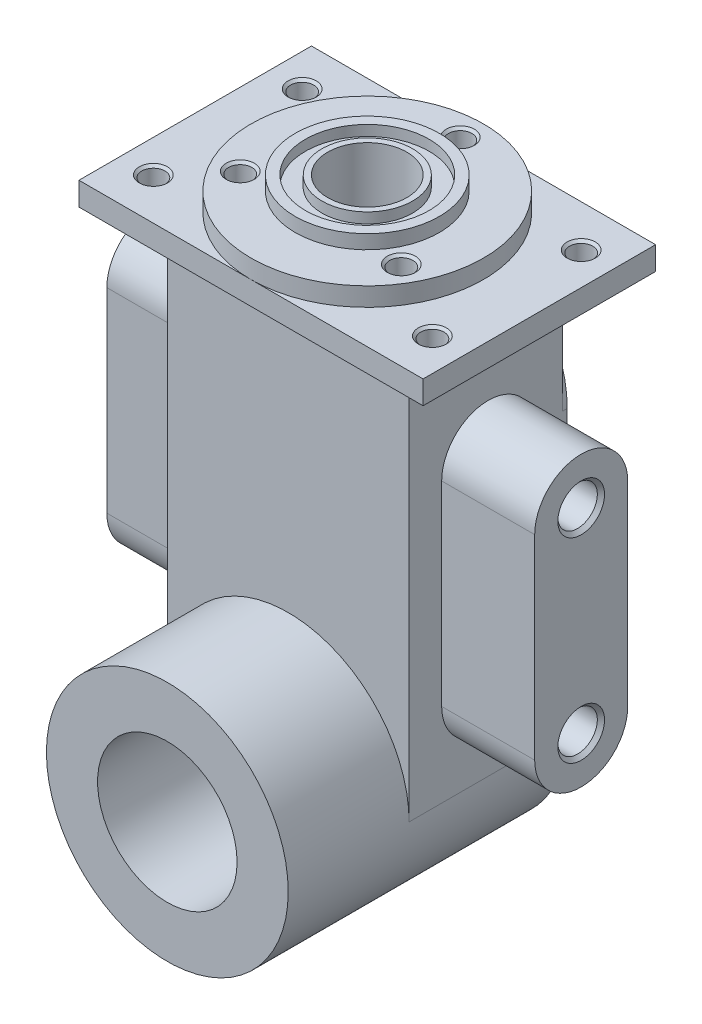
from build123d import *

# Parameters (mm, degrees)
EXTRUDE_1_DEPTH              = 34
EXTRUDE_START                = 87
SKETCH_4_W                   = 74
SKETCH_4_H                   = 50
EXTRUDE_2_DEPTH              = 5
SKETCH_5_R                   = 25
EXTRUDE_3_DEPTH              = 4
SKETCH_6_R                   = 15.5
EXTRUDE_4_DEPTH              = 3
EXTRUDE_5_DEPTH              = 46
SKETCH_8_W                   = 52
SKETCH_8_H                   = 27
EXTRUDE_6_DEPTH              = 33
EXTRUDE_START_2              = -34
SKETCH_9_R                   = 26
EXTRUDE_7_DEPTH              = 60
CUT_EXTRUDE_1_DEPTH          = 30
SKETCH_11_R                  = 15
CUT_EXTRUDE_2_DEPTH          = 129.611819053
CUT_EXTRUDE_3_REACH          = 148.086
CUT_EXTRUDE_3_END_RADIUS     = 16
SKETCH_12_R                  = 8.5
SKETCH_13_R                  = 13.3
SKETCH_13_R_2                = 9.75
CUT_EXTRUDE_4_DEPTH          = 2.25
HOLE_WIZARD_M6_1_D           = 5
HOLE_WIZARD_M6_1_CSINK_D     = 6.05
HOLE_WIZARD_M6_1_CSINK_ANGLE = 90
HOLE_WIZARD_M6_2_D           = 5
HOLE_WIZARD_M6_2_DEPTH       = 14.497848452
HOLE_WIZARD_M6_2_CSINK_D     = 6.05
HOLE_WIZARD_M6_2_CSINK_ANGLE = 90
HOLE_WIZARD_M6_2_TIP         = 1.502151548
HOLE_WIZARD_M6_3_D           = 5
HOLE_WIZARD_M6_3_DEPTH       = 5
HOLE_WIZARD_M6_3_CSINK_D     = 6.05
HOLE_WIZARD_M6_3_CSINK_ANGLE = 90
HOLE_WIZARD_M10_1_AT_2_COUNT = 2
HOLE_WIZARD_M10_1_AT_2_PITCH = 42


with BuildPart() as part:
    # 草图1 → 凸台-拉伸1 (new body)
    with BuildSketch(Plane.XY):
        with BuildLine():
            Line((-26, 0), (-26, 60))
            ThreePointArc((-26, 60), (0, 86), (26, 60))
            Line((26, 60), (26, 0))
            ThreePointArc((26, 0), (0, -26), (-26, 0))
        make_face()
    extrude(amount=EXTRUDE_1_DEPTH)

    # 草图7 → 凸台-拉伸5 (add, symmetric)
    with BuildSketch(Plane(origin=(0, 0, 0), x_dir=(0, 0, -1), z_dir=(1, 0, 0))):
        with BuildLine():
            Line((-27, 60), (-27, 18))
            ThreePointArc((-27, 18), (-17, 8), (-7, 18))
            Line((-7, 18), (-7, 60))
            ThreePointArc((-7, 60), (-17, 70), (-27, 60))
        make_face()
    extrude(amount=EXTRUDE_5_DEPTH, both=True)



with BuildPart() as body_2:
    # 草图4 → 凸台-拉伸2 (new body)
    with BuildSketch(Plane(origin=(0, 0, 0), x_dir=(1, 0, 0), z_dir=(0, 1, 0)).offset(EXTRUDE_START)):
        with Locations((0, -17)):
            Rectangle(SKETCH_4_W, SKETCH_4_H)
    extrude(amount=EXTRUDE_2_DEPTH)

    # 草图5 → 凸台-拉伸3 (add)
    with BuildSketch(Plane(origin=(0, 92, 0), x_dir=(1, 0, 0), z_dir=(0, 1, 0))):
        with Locations(Location((0, -17, 0), (0, 0, 270))):
            Circle(SKETCH_5_R)
    extrude(amount=EXTRUDE_3_DEPTH)

    # 草图6 → 凸台-拉伸4 (add)
    with BuildSketch(Plane(origin=(0, 96, 0), x_dir=(1, 0, 0), z_dir=(0, 1, 0))):
        with Locations(Location((0, -17, 0), (0, 0, 270))):
            Circle(SKETCH_6_R)
    extrude(amount=EXTRUDE_4_DEPTH)


with BuildPart() as part_1:
    add(part.part)

    add(body_2.part)  # 凸台-拉伸6 merges body 2
    # 草图8 → 凸台-拉伸6 (add)
    with BuildSketch(Plane.XY.offset(34)):
        with Locations((0, 73.5)):
            Rectangle(SKETCH_8_W, SKETCH_8_H)
    extrude(amount=-EXTRUDE_6_DEPTH)

    # 草图9 → 凸台-拉伸7 (add)
    with BuildSketch(Plane.XY.offset(34).offset(EXTRUDE_START_2)):
        Circle(SKETCH_9_R)
    extrude(amount=EXTRUDE_7_DEPTH)

    # 草图10 → 切除-拉伸1 (cut)
    with BuildSketch(Plane(origin=(0, 0, 0), x_dir=(-1, 0, 0), z_dir=(0, 0, -1))):
        with BuildLine():
            Line((-16, 0), (-16, 60))
            ThreePointArc((-16, 60), (0, 76), (16, 60))
            Line((16, 60), (16, 0))
            ThreePointArc((16, 0), (0, -16), (-16, 0))
        make_face()
    extrude(amount=-CUT_EXTRUDE_1_DEPTH, mode=Mode.SUBTRACT)

    # 草图11 → 切除-拉伸2 (cut, through all)
    with BuildSketch(Plane.XY.offset(60)):
        Circle(SKETCH_11_R)
    extrude(amount=-CUT_EXTRUDE_2_DEPTH, mode=Mode.SUBTRACT)

    # 切除-拉伸3: up to this cylinder (the profile starts outside it)
    cut_extrude_3_end = Plane(origin=(0, 60, 17), z_dir=(0, 0, -1)) * Cylinder(CUT_EXTRUDE_3_END_RADIUS, 329.172, mode=Mode.PRIVATE)
    # 草图12 → 切除-拉伸3 (cut, up to the surface)
    with BuildSketch(Plane(origin=(0, 99, 0), x_dir=(1, 0, 0), z_dir=(0, 1, 0)), mode=Mode.PRIVATE) as cut_extrude_3_sk1:
        with Locations(Location((0, -17, 0), (0, 0, 270))):
            Circle(SKETCH_12_R)
    cut_extrude_3_tool1 = extrude(cut_extrude_3_sk1.sketch, amount=-CUT_EXTRUDE_3_REACH, mode=Mode.PRIVATE) - cut_extrude_3_end
    add(cut_extrude_3_tool1.solids().sort_by_distance((0, 99, 17))[0], mode=Mode.SUBTRACT)

    # 草图13 → 切除-拉伸4 (cut)
    with BuildSketch(Plane(origin=(0, 99, 0), x_dir=(1, 0, 0), z_dir=(0, 1, 0))):
        with Locations(Location((0, -17, 0), (0, 0, 270))):
            Circle(SKETCH_13_R)
        with Locations(Location((0, -17, 0), (0, 0, 270))):
            Circle(SKETCH_13_R_2, mode=Mode.SUBTRACT)
    extrude(amount=-CUT_EXTRUDE_4_DEPTH, mode=Mode.SUBTRACT)

    # M6 螺纹孔1 (through all)
    with Locations(Plane(origin=(0, 96, 0), x_dir=(1, 0, 0), z_dir=(0, 1, 0))):
        with Locations((0, 3)):
            CounterSinkHole(HOLE_WIZARD_M6_1_D / 2, HOLE_WIZARD_M6_1_CSINK_D / 2, counter_sink_angle=HOLE_WIZARD_M6_1_CSINK_ANGLE)

    # M6 螺纹孔2
    with Locations(Plane(origin=(0, 96, 0), x_dir=(1, 0, 0), z_dir=(0, 1, 0))):
        with Locations((17.320508076, -27), (-17.320508076, -27)):
            CounterSinkHole(HOLE_WIZARD_M6_2_D / 2, HOLE_WIZARD_M6_2_CSINK_D / 2, depth=HOLE_WIZARD_M6_2_DEPTH, counter_sink_angle=HOLE_WIZARD_M6_2_CSINK_ANGLE)
            with Locations((0, 0, -(HOLE_WIZARD_M6_2_DEPTH + HOLE_WIZARD_M6_2_TIP / 2))):  # 118° drill point
                Cone(0, HOLE_WIZARD_M6_2_D / 2, HOLE_WIZARD_M6_2_TIP, mode=Mode.SUBTRACT)

    # M6 螺纹孔3
    with Locations(Plane(origin=(0, 92, 0), x_dir=(1, 0, 0), z_dir=(0, 1, 0))):
        with Locations((30, -1), (0, -17), (-30, -1), (-30, -33), (30, -33)):
            CounterSinkHole(HOLE_WIZARD_M6_3_D / 2, HOLE_WIZARD_M6_3_CSINK_D / 2, depth=HOLE_WIZARD_M6_3_DEPTH, counter_sink_angle=HOLE_WIZARD_M6_3_CSINK_ANGLE)

    # 草图21 → M10 螺纹孔1 (revolve, cut)
    with BuildSketch(Plane(origin=(46, 60, 17), x_dir=(0, 0, -1), z_dir=(0, 1, 0))):
        Polygon((0, 0), (0, 22), (4.25, 19.446342369), (4.25, 0.775), (5.025, 0), align=None)
    hole_wizard_m10_1 = revolve(axis=Axis((52.35, 60, 17), (-1, 0, 0)), mode=Mode.SUBTRACT)

    # M10 螺纹孔1 at 2: M10 螺纹孔1 ×2
    with Locations(*[(0, -i * HOLE_WIZARD_M10_1_AT_2_PITCH, 0) for i in range(1, HOLE_WIZARD_M10_1_AT_2_COUNT)]):
        add(hole_wizard_m10_1, mode=Mode.SUBTRACT)

    # 镜向1: M10 螺纹孔1 across plane
    add(hole_wizard_m10_1.mirror(Plane(origin=(0, 0, 0), x_dir=(0, 0, 1), z_dir=(1, 0, 0))), mode=Mode.SUBTRACT)

    # 镜向1 copy 1 sketch → 镜向1 copy 1 (revolve, cut)
    with BuildSketch(Plane(origin=(-46, 18, 17), x_dir=(0, 0, -1), z_dir=(0, 1, 0))):
        Polygon((0, 0), (0, -22), (4.25, -19.446342369), (4.25, -0.775), (5.025, 0), align=None)
    revolve(axis=Axis((-52.35, 18, 17), (-1, 0, 0)), mode=Mode.SUBTRACT)


solid = part_1.part
